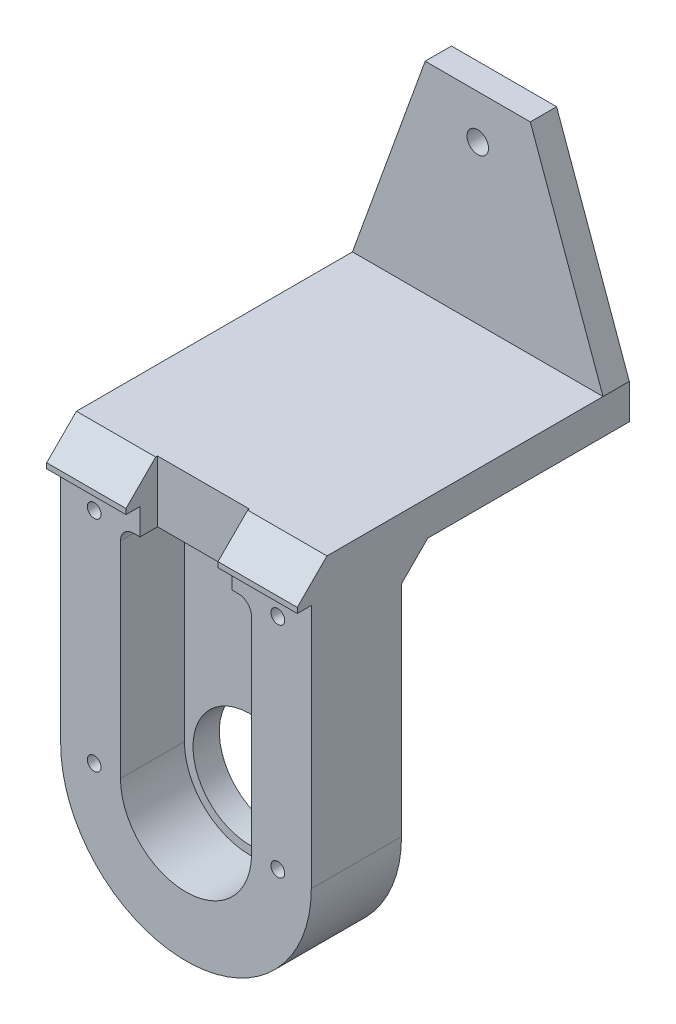
from build123d import *

# Parameters (mm, degrees)
MODEL_R             = 0.7834936
EXTRUDE_1_DEPTH     = 10.3
MODEL_3_W           = 10.5
MODEL_3_H           = 3
EXTRUDE_2_DEPTH     = 8.3
MODEL_4_R           = 6.5
EXTRUDE_3_DEPTH     = 3
SKETCH_2_W          = 28.6
SKETCH_2_H          = 4
EXTRUDE_4_DEPTH     = 1.6
SKETCH_3_W          = 10.5
SKETCH_3_H          = 5.089019843
CUT_EXTRUDE_1_DEPTH = 5.6
MODEL_5_W           = 28.6
MODEL_5_H           = 4
EXTRUDE_5_DEPTH     = 26
MODEL_6_R           = 0.7834936
EXTRUDE_6_DEPTH     = 3
SKETCH_4_R          = 1.229367
EXTRUDE_7_DEPTH     = 3
SKETCH_4_3_R        = 1.229367
CUT_EXTRUDE_2_DEPTH = 8
CHAMFER_1_SIZE      = 3
CUT_EXTRUDE_3_DEPTH = 30


with BuildPart() as part:
    # Model → 凸台-拉伸1 (new body)
    with BuildSketch(Plane.XY):
        with BuildLine():
            Line((-37.212112801, 31.669809042), (-37.212112801, -0.330212606))
            ThreePointArc((-37.212112801, -0.330212606), (-22.912101977, -14.630201782), (-8.612112801, -0.330190958))
            Line((-8.612112801, -0.330190958), (-8.612112801, 31.669809042))
            Line((-8.612112801, 31.669809042), (-37.212112801, 31.669809042))
        make_face()
        with BuildLine():
            Line((-28.162112801, 27.669809042), (-17.662112801, 27.669809042))
            Line((-17.662112801, 27.669809042), (-17.662112801, 24.669809042))
            Line((-17.662112801, 24.669809042), (-16.932112801, 24.669809042))
            ThreePointArc((-16.932112801, 24.669809042), (-15.87145263, 24.230469214), (-15.432112801, 23.169809042))
            Line((-15.432112801, 23.169809042), (-15.432112801, -0.330190958))
            ThreePointArc((-15.432112801, -0.330190958), (-22.912112801, -7.810190958), (-30.392112801, -0.330190958))
            Line((-30.392112801, -0.330190958), (-30.392112801, 23.169809042))
            ThreePointArc((-30.392112801, 23.169809042), (-29.952772973, 24.230469214), (-28.892112801, 24.669809042))
            Line((-28.892112801, 24.669809042), (-28.162112801, 24.669809042))
            Line((-28.162112801, 24.669809042), (-28.162112801, 27.669809042))
        make_face(mode=Mode.SUBTRACT)
        with Locations((-33.392112801, 24.669809042)):
            Circle(MODEL_R, mode=Mode.SUBTRACT)
        with Locations((-12.432112801, 24.669809042)):
            Circle(MODEL_R, mode=Mode.SUBTRACT)
        with Locations((-33.392112801, -0.330190958)):
            Circle(MODEL_R, mode=Mode.SUBTRACT)
        with Locations((-12.432112801, -0.330190958)):
            Circle(MODEL_R, mode=Mode.SUBTRACT)
    extrude(amount=EXTRUDE_1_DEPTH)

    # Model<3> → 凸台-拉伸2 (add)
    with BuildSketch(Plane.XY):
        with Locations((-22.912112801, 26.169809042)):
            Rectangle(MODEL_3_W, MODEL_3_H)
    extrude(amount=EXTRUDE_2_DEPTH)

    # Model<4> → 凸台-拉伸3 (add)
    with BuildSketch(Plane.XY):
        with BuildLine():
            Line((-17.662112801, 24.669809042), (-28.162112801, 24.669809042))
            Line((-28.162112801, 24.669809042), (-28.892112801, 24.669809042))
            ThreePointArc((-28.892112801, 24.669809042), (-29.952772973, 24.230469214), (-30.392112801, 23.169809042))
            Line((-30.392112801, 23.169809042), (-30.392112801, -0.330190958))
            ThreePointArc((-30.392112801, -0.330190958), (-22.912112801, -7.810190958), (-15.432112801, -0.330190958))
            Line((-15.432112801, -0.330190958), (-15.432112801, 23.169809042))
            ThreePointArc((-15.432112801, 23.169809042), (-15.87145263, 24.230469214), (-16.932112801, 24.669809042))
            Line((-16.932112801, 24.669809042), (-17.662112801, 24.669809042))
        make_face()
        with Locations((-22.912112801, -0.330190958)):
            Circle(MODEL_4_R, mode=Mode.SUBTRACT)
    extrude(amount=EXTRUDE_3_DEPTH)

    # 草图2 → 凸台-拉伸4 (add)
    with BuildSketch(Plane.XY.offset(10.3)):
        with Locations((-22.912112801, 29.669809042)):
            Rectangle(SKETCH_2_W, SKETCH_2_H)
    extrude(amount=EXTRUDE_4_DEPTH)

    # 草图3 → 切除-拉伸1 (cut)
    with BuildSketch(Plane.XZ.offset(-27.669809042)):
        with Locations((-22.912112801, 10.844509922)):
            Rectangle(SKETCH_3_W, SKETCH_3_H)
    extrude(amount=-CUT_EXTRUDE_1_DEPTH, mode=Mode.SUBTRACT)

    # Model<5> → 凸台-拉伸5 (add)
    with BuildSketch(Plane.XY):
        with Locations((-22.912112801, 29.669809042)):
            Rectangle(MODEL_5_W, MODEL_5_H)
    extrude(amount=-EXTRUDE_5_DEPTH)

    # Model<6> → 凸台-拉伸6 (add)
    with BuildSketch(Plane.XY):
        with Locations((-12.432112801, -0.330190958)):
            Circle(MODEL_6_R)
        with Locations((-33.392112801, -0.330190958)):
            Circle(MODEL_6_R)
        with Locations((-12.432112801, 24.669809042)):
            Circle(MODEL_6_R)
        with Locations((-33.392112801, 24.669809042)):
            Circle(MODEL_6_R)
    extrude(amount=EXTRUDE_6_DEPTH)

    # 草图4 → 凸台-拉伸7 (add)
    with BuildSketch(Plane(origin=(0, 0, -26), x_dir=(-1, 0, 0), z_dir=(0, 0, -1))):
        Polygon((37.212112801, 31.669809042), (28.912112801, 54.669809042), (16.912112801, 54.669809042), (8.612112801, 31.669809042), align=None)
        with Locations((22.912112801, 49.669809042)):
            Circle(SKETCH_4_R, mode=Mode.SUBTRACT)
    extrude(amount=-EXTRUDE_7_DEPTH)

    # 草图4<3> → 切除-拉伸2 (cut)
    with BuildSketch(Plane(origin=(0, 0, -26), x_dir=(-1, 0, 0), z_dir=(0, 0, -1))):
        with Locations((12.612112801, 29.669809042)):
            Circle(SKETCH_4_3_R)
        with Locations((33.212112801, 29.669809042)):
            Circle(SKETCH_4_3_R)
        with Locations((22.912112801, 29.669809042)):
            Circle(SKETCH_4_3_R)
    extrude(amount=-CUT_EXTRUDE_2_DEPTH, mode=Mode.SUBTRACT)

    # 倒角1
    chamfer_1_edges = [part.edges().sort_by_distance(p)[0] for p in [
        (-22.912112801, 27.669809042, 0),
    ]]
    chamfer(chamfer_1_edges, length=CHAMFER_1_SIZE)

    # 草图5 → 切除-拉伸3 (cut)
    with BuildSketch(Plane(origin=(-8.612112801, 0, 0), x_dir=(0, 0, -1), z_dir=(1, 0, 0))):
        Polygon((-11.9, 31.669809042), (-11.9, 28.278558322), (-8.50874928, 31.669809042), align=None)
    extrude(amount=-CUT_EXTRUDE_3_DEPTH, mode=Mode.SUBTRACT)


solid = part.part
